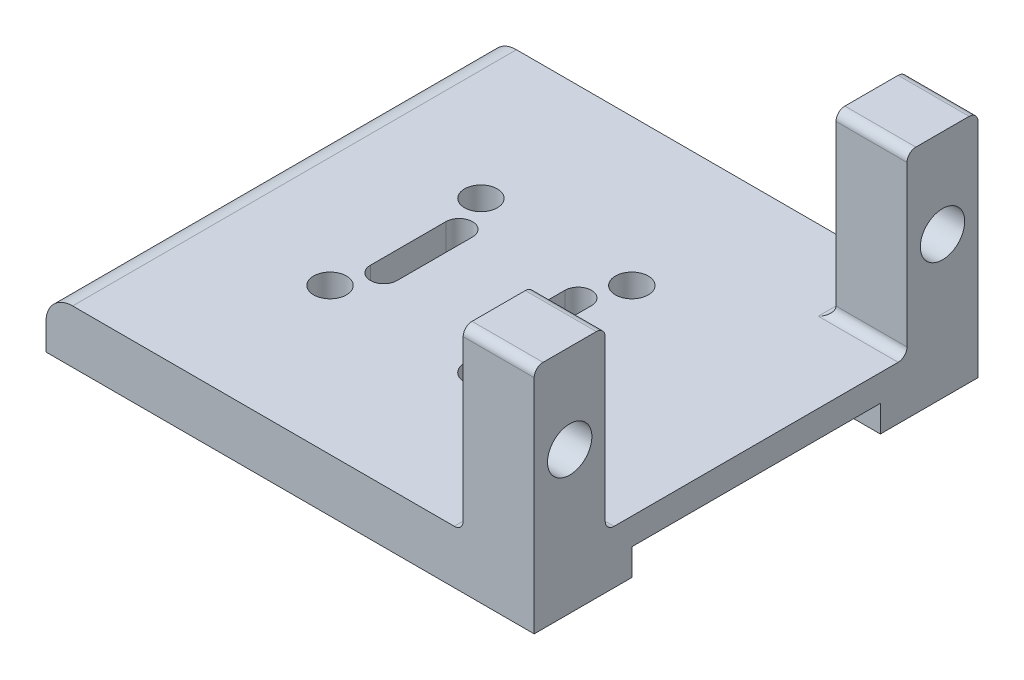
from build123d import *

# Parameters (mm, degrees)
SKETCH1_W           = 60
SKETCH1_H           = 50
BOSS_EXTRUDE1_DEPTH = 6
SKETCH2_W           = 8
SKETCH2_H           = 8
BOSS_EXTRUDE2_DEPTH = 20
CUT_EXTRUDE1_REACH  = 84.316
SKETCH3_R           = 2.5
SKETCH4_W           = 28
SKETCH4_H           = 28
SKETCH4_W_2         = 17
CUT_EXTRUDE2_DEPTH  = 3
CUT_EXTRUDE3_REACH  = 83.419
SKETCH5_R           = 1.85
SKETCH6_W           = 50
SKETCH6_H           = 6
CUT_EXTRUDE4_DEPTH  = 5
FILLET1_R           = 1
FILLET2_R           = 1
FILLET4_R           = 3


with BuildPart() as part:
    # Sketch1 → Boss-Extrude1 (new body)
    with BuildSketch(Plane(origin=(0, 0, 0), x_dir=(1, 0, 0), z_dir=(0, 1, 0))):
        with Locations((30, 25)):
            Rectangle(SKETCH1_W, SKETCH1_H)
    extrude(amount=BOSS_EXTRUDE1_DEPTH)

    # Sketch2 → Boss-Extrude2 (add)
    with BuildSketch(Plane(origin=(0, 6, 0), x_dir=(1, 0, 0), z_dir=(0, 1, 0))):
        with Locations((56, 4)):
            Rectangle(SKETCH2_W, SKETCH2_H)
    boss_extrude2 = extrude(amount=BOSS_EXTRUDE2_DEPTH)

    # Sketch3 → Cut-Extrude1 (cut, up to next)
    with BuildSketch(Plane(origin=(60, 0, 0), x_dir=(0, 0, -1), z_dir=(1, 0, 0)), mode=Mode.PRIVATE) as cut_extrude1_sk1:
        with Locations((4, 16)):
            Circle(SKETCH3_R)
    cut_extrude1_tool1 = extrude(cut_extrude1_sk1.sketch, amount=-CUT_EXTRUDE1_REACH, mode=Mode.PRIVATE) & part.part
    cut_extrude1 = cut_extrude1_tool1.solids().sort_by_distance((60, 16, -4))[0]
    add(cut_extrude1, mode=Mode.SUBTRACT)

    # Mirror1: Boss-Extrude2, Cut-Extrude1 across plane
    add(boss_extrude2.mirror(Plane.XY.offset(-25)))
    add(cut_extrude1.mirror(Plane.XY.offset(-25)), mode=Mode.SUBTRACT)

    # Sketch4 → Cut-Extrude2 (cut)
    with BuildSketch(Plane.XZ):
        with Locations((29, -25)):
            Rectangle(SKETCH4_W, SKETCH4_H)
        with Locations((51.5, -25)):
            Rectangle(SKETCH4_W_2, SKETCH4_H)
    extrude(amount=-CUT_EXTRUDE2_DEPTH, mode=Mode.SUBTRACT)

    # Sketch5 → Cut-Extrude3 (cut, up to next)
    with BuildSketch(Plane.XZ.offset(-3), mode=Mode.PRIVATE) as cut_extrude3_sk1:
        with Locations(Location((20.5, -16.5, 0), (0, 0, 270))):
            Circle(SKETCH5_R)
    cut_extrude3_tool1 = extrude(cut_extrude3_sk1.sketch, amount=-CUT_EXTRUDE3_REACH, mode=Mode.PRIVATE) & part.part
    # Sketch5 → Cut-Extrude3 (cut, up to next)
    with BuildSketch(Plane.XZ.offset(-3), mode=Mode.PRIVATE) as cut_extrude3_sk2:
        with Locations(Location((37.5, -16.5, 0), (0, 0, 270))):
            Circle(SKETCH5_R)
    cut_extrude3_tool2 = extrude(cut_extrude3_sk2.sketch, amount=-CUT_EXTRUDE3_REACH, mode=Mode.PRIVATE) & part.part
    # Sketch5 → Cut-Extrude3 (cut, up to next)
    with BuildSketch(Plane.XZ.offset(-3), mode=Mode.PRIVATE) as cut_extrude3_sk3:
        with Locations(Location((37.5, -33.5, 0), (0, 0, 270))):
            Circle(SKETCH5_R)
    cut_extrude3_tool3 = extrude(cut_extrude3_sk3.sketch, amount=-CUT_EXTRUDE3_REACH, mode=Mode.PRIVATE) & part.part
    # Sketch5 → Cut-Extrude3 (cut, up to next)
    with BuildSketch(Plane.XZ.offset(-3), mode=Mode.PRIVATE) as cut_extrude3_sk4:
        with Locations(Location((20.5, -33.5, 0), (0, 0, 270))):
            Circle(SKETCH5_R)
    cut_extrude3_tool4 = extrude(cut_extrude3_sk4.sketch, amount=-CUT_EXTRUDE3_REACH, mode=Mode.PRIVATE) & part.part
    # Sketch5 → Cut-Extrude3 (cut, up to next)
    with BuildSketch(Plane.XZ.offset(-3), mode=Mode.PRIVATE) as cut_extrude3_sk5:
        with BuildLine():
            Line((37.2, -20.75), (37.2, -29.25))
            ThreePointArc((37.2, -29.25), (35.7, -30.75), (34.2, -29.25))
            Line((34.2, -29.25), (34.2, -20.75))
            ThreePointArc((34.2, -20.75), (35.7, -19.25), (37.2, -20.75))
        make_face()
    cut_extrude3_tool5 = extrude(cut_extrude3_sk5.sketch, amount=-CUT_EXTRUDE3_REACH, mode=Mode.PRIVATE) & part.part
    # Sketch5 → Cut-Extrude3 (cut, up to next)
    with BuildSketch(Plane.XZ.offset(-3), mode=Mode.PRIVATE) as cut_extrude3_sk6:
        with BuildLine():
            Line((23.8, -20.75), (23.8, -29.25))
            ThreePointArc((23.8, -29.25), (22.3, -30.75), (20.8, -29.25))
            Line((20.8, -29.25), (20.8, -20.75))
            ThreePointArc((20.8, -20.75), (22.3, -19.25), (23.8, -20.75))
        make_face()
    cut_extrude3_tool6 = extrude(cut_extrude3_sk6.sketch, amount=-CUT_EXTRUDE3_REACH, mode=Mode.PRIVATE) & part.part
    add(cut_extrude3_tool1.solids().sort_by_distance((20.5, 3, -16.5))[0], mode=Mode.SUBTRACT)
    add(cut_extrude3_tool2.solids().sort_by_distance((37.5, 3, -16.5))[0], mode=Mode.SUBTRACT)
    add(cut_extrude3_tool3.solids().sort_by_distance((37.5, 3, -33.5))[0], mode=Mode.SUBTRACT)
    add(cut_extrude3_tool4.solids().sort_by_distance((20.5, 3, -33.5))[0], mode=Mode.SUBTRACT)
    add(cut_extrude3_tool5.solids().sort_by_distance((35.7, 3, -25))[0], mode=Mode.SUBTRACT)
    add(cut_extrude3_tool6.solids().sort_by_distance((22.3, 3, -25))[0], mode=Mode.SUBTRACT)

    # Sketch6 → Cut-Extrude4 (cut)
    with BuildSketch(Plane.ZY):
        with Locations((-25, 3)):
            Rectangle(SKETCH6_W, SKETCH6_H)
    extrude(amount=-CUT_EXTRUDE4_DEPTH, mode=Mode.SUBTRACT)

    # Fillet1
    fillet1_edges = [part.edges().sort_by_distance(p)[0] for p in [
        (56, 26, -8),
        (56, 26, 0),
        (56, 26, -50),
        (56, 26, -42),
    ]]
    fillet(fillet1_edges, radius=FILLET1_R)

    # Fillet2
    fillet2_edges = [part.edges().sort_by_distance(p)[0] for p in [
        (56, 6, -8),
        (52, 6, -4),
        (56, 6, -42),
        (52, 6, -46),
    ]]
    fillet(fillet2_edges, radius=FILLET2_R)

    # Fillet4
    fillet4_edges = [part.edges().sort_by_distance(p)[0] for p in [
        (5, 6, -25),
    ]]
    fillet(fillet4_edges, radius=FILLET4_R)


solid = part.part
